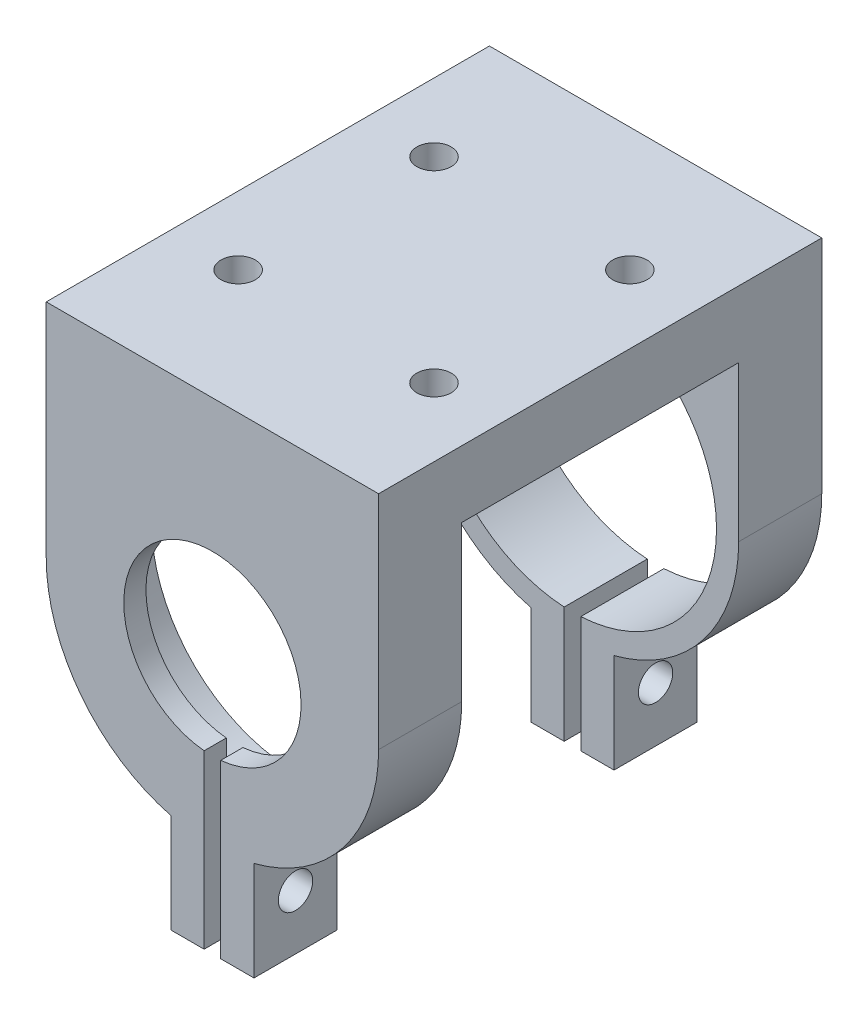
from build123d import *

# Parameters (mm, degrees)
BOSS_EXTRUDE1_DEPTH   = 20
SKETCH2_W             = 3
SKETCH2_H             = 10.5
BOSS_EXTRUDE2_DEPTH   = 20
SKETCH4_W             = 30
SKETCH4_H             = 40
BOSS_EXTRUDE3_DEPTH   = 5
SKETCH5_W             = 25
SKETCH5_H             = 37.478347352
CUT_EXTRUDE2_DEPTH    = 13
SKETCH6_R             = 1.55
MOTORMOUNTHOLES_DEPTH = 6
CLAMPHOLES_REACH      = 38.094
SKETCH8_R             = 1.55
ENDSTOPPER_DEPTH      = 2
CUT_EXTRUDE7_START    = -15
SKETCH10_W            = 25
SKETCH10_H            = 37.478347352
CUT_EXTRUDE7_DEPTH    = 13
SKETCH11_W            = 25
SKETCH11_H            = 10.633114773
CUT_EXTRUDE8_DEPTH    = 4


with BuildPart() as part:
    # Sketch1 → Boss-Extrude1 (new, symmetric)
    with BuildSketch(Plane.XY):
        with BuildLine():
            Line((-15, 15), (-15, 0))
            ThreePointArc((-15, 0), (-10.606601721, 10.606601715), (-8e-09, 15))
            Line((-8e-09, 15), (-15, 15))
        make_face()
        with BuildLine():
            Line((15, 15), (-8e-09, 15))
            ThreePointArc((-8e-09, 15), (10.606601715, 10.606601721), (15, 0))
            Line((15, 0), (15, 15))
        make_face()
        with BuildLine():
            ThreePointArc((-8e-09, 15), (-10.606601721, 10.606601715), (-15, 0))
            ThreePointArc((-15, 0), (-10.86853256, -10.338036564), (-0.75, -14.981238267))
            Line((-0.75, -14.981238267), (-0.75, -12.978347352))
            ThreePointArc((-0.75, -12.978347352), (-8.923284149, 9.453835201), (13, 0))
            ThreePointArc((13, 0), (9.453835201, -8.923284149), (0.75, -12.978347352))
            Line((0.75, -12.978347352), (0.75, -14.981238267))
            ThreePointArc((0.75, -14.981238267), (10.86853256, -10.338036564), (15, 0))
            ThreePointArc((15, 0), (10.606601715, 10.606601721), (-8e-09, 15))
        make_face()
    extrude(amount=BOSS_EXTRUDE1_DEPTH, both=True)

    # Sketch2 → Boss-Extrude2 (add, symmetric)
    with BuildSketch(Plane.XY):
        with Locations((-2.25, -18.228347352)):
            Rectangle(SKETCH2_W, SKETCH2_H)
        with Locations((2.25, -18.228347352)):
            Rectangle(SKETCH2_W, SKETCH2_H)
    extrude(amount=BOSS_EXTRUDE2_DEPTH, both=True)

    # Sketch4 → Boss-Extrude3 (add)
    with BuildSketch(Plane(origin=(0, 15, 0), x_dir=(1, 0, 0), z_dir=(0, 1, 0))):
        Rectangle(SKETCH4_W, SKETCH4_H)
    extrude(amount=BOSS_EXTRUDE3_DEPTH)

    # Sketch5 → Cut-Extrude2 (cut)
    with BuildSketch(Plane(origin=(15, 0, 0), x_dir=(0, 0, -1), z_dir=(1, 0, 0))):
        with Locations((0, -4.739173676)):
            Rectangle(SKETCH5_W, SKETCH5_H)
    extrude(amount=-CUT_EXTRUDE2_DEPTH, mode=Mode.SUBTRACT)

    # Sketch6 → MotorMountHoles (cut)
    with BuildSketch(Plane(origin=(0, 20, 0), x_dir=(1, 0, 0), z_dir=(0, 1, 0))):
        with Locations(Location((-8.838834765, 8.838834765, 0), (0, 0, 270))):
            Circle(SKETCH6_R)
        with Locations(Location((8.838834765, 8.838834765, 0), (0, 0, 270))):
            Circle(SKETCH6_R)
        with Locations(Location((8.838834765, -8.838834765, 0), (0, 0, 270))):
            Circle(SKETCH6_R)
        with Locations(Location((-8.838834765, -8.838834765, 0), (0, 0, 270))):
            Circle(SKETCH6_R)
    extrude(amount=-MOTORMOUNTHOLES_DEPTH, mode=Mode.SUBTRACT)

    # ClampHoles: up to this face of the body (flat: up to its plane)
    clampholes_end = Plane(part.part.faces().sort_by_distance((3.75, -19.00101745, 16.25))[0])
    # Sketch8 → ClampHoles (cut, up to the picked face)
    with BuildSketch(Plane.ZY.offset(3.75), mode=Mode.PRIVATE) as clampholes_sk1:
        with Locations(Location((16.25, -18.523687548, 0), (0, 0, 270))):
            Circle(SKETCH8_R)
    clampholes_tool1 = split(extrude(clampholes_sk1.sketch, amount=-CLAMPHOLES_REACH, mode=Mode.PRIVATE), bisect_by=clampholes_end, keep=Keep.BOTH, mode=Mode.PRIVATE)
    # Sketch8 → ClampHoles (cut, up to the picked face)
    with BuildSketch(Plane.ZY.offset(3.75), mode=Mode.PRIVATE) as clampholes_sk2:
        with Locations(Location((-16.25, -18.523687548, 0), (0, 0, 270))):
            Circle(SKETCH8_R)
    clampholes_tool2 = split(extrude(clampholes_sk2.sketch, amount=-CLAMPHOLES_REACH, mode=Mode.PRIVATE), bisect_by=clampholes_end, keep=Keep.BOTH, mode=Mode.PRIVATE)
    add(clampholes_tool1.solids().sort_by(Axis((-3.75, -18.523688, 16.25), (1, 0, 0)))[0], mode=Mode.SUBTRACT)
    add(clampholes_tool2.solids().sort_by(Axis((-3.75, -18.523688, -16.25), (1, 0, 0)))[0], mode=Mode.SUBTRACT)

    # Sketch9 → EndStopper (add)
    with BuildSketch(Plane.XY.offset(20)):
        with BuildLine():
            ThreePointArc((13, 0), (-8.923284149, 9.453835201), (-0.75, -12.978347352))
            Line((-0.75, -12.978347352), (-0.75, -7.964766161))
            ThreePointArc((-0.75, -7.964766161), (-5.385164807, 5.916079783), (8, 0))
            ThreePointArc((8, 0), (5.916079783, -5.385164807), (0.75, -7.964766161))
            Line((0.75, -7.964766161), (0.75, -12.978347352))
            ThreePointArc((0.75, -12.978347352), (9.453835201, -8.923284149), (13, 0))
        make_face()
    extrude(amount=-ENDSTOPPER_DEPTH)

    # Sketch10 → Cut-Extrude7 (cut)
    with BuildSketch(Plane(origin=(0, 0, 0), x_dir=(0, 0, -1), z_dir=(1, 0, 0)).offset(CUT_EXTRUDE7_START)):
        with Locations((0, -4.739173676)):
            Rectangle(SKETCH10_W, SKETCH10_H)
    extrude(amount=CUT_EXTRUDE7_DEPTH, mode=Mode.SUBTRACT)

    # Sketch11 → Cut-Extrude8 (cut)
    with BuildSketch(Plane.ZY.offset(2)):
        with Locations((0, -18.161789965)):
            Rectangle(SKETCH11_W, SKETCH11_H)
    extrude(amount=-CUT_EXTRUDE8_DEPTH, mode=Mode.SUBTRACT)


solid = part.part
